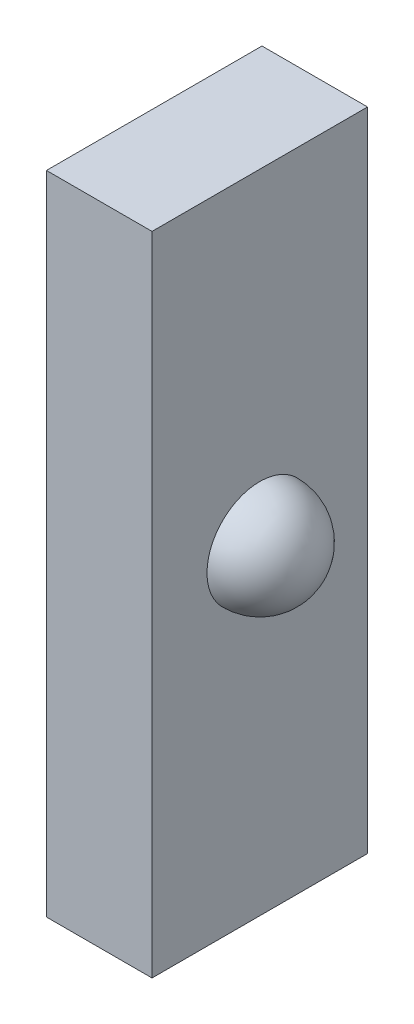
from build123d import *

# Parameters (mm, degrees)
REVOLVE_1_ANGLE            = 180
EXTRUDE_1_DEPTH            = 10
EXTRUDE_1_DEPTH_BACK       = 10
SKETCH_5_W                 = 9.796885282
SKETCH_5_H                 = 60
PATTERN_LINEAR_1_COUNT     = 2
PATTERN_LINEAR_1_PITCH     = 18.4
PATTERN_LINEAR_1_COL_COUNT = 2
PATTERN_LINEAR_1_COL_PITCH = 18.4


with BuildPart() as part:
    # 草图1 → 旋转1 (revolve)
    with BuildSketch(Plane(origin=(0, 0, 0), x_dir=(0, 0, -1), z_dir=(1, 0, 0))):
        with BuildLine():
            Line((0, 4.9), (0, -4.9))
            ThreePointArc((0, -4.9), (4.9, 0), (0, 4.9))
        make_face()
    revolve(axis=Axis((0, 4.9, 0), (0, -1, 0)), revolution_arc=REVOLVE_1_ANGLE)

    # 草图5 → 凸台-拉伸1 (add, two sides: drawn at the far end of the back side and taken through both)
    with BuildSketch(Plane.XY.offset(-EXTRUDE_1_DEPTH_BACK)):
        with Locations((-4.898442641, 0)):
            Rectangle(SKETCH_5_W, SKETCH_5_H)
    extrude(amount=EXTRUDE_1_DEPTH + EXTRUDE_1_DEPTH_BACK)

    # 草图7 → 切除-旋转1 (revolve, cut)
    with BuildSketch(Plane.XY):
        with BuildLine():
            Line((-9.796885282, 9.2), (-9.796885282, -9.2))
            ThreePointArc((-9.796885282, -9.2), (-18.996885282, 0), (-9.796885282, 9.2))
        make_face()
    cut_revolve_1 = revolve(axis=Axis((-9.796885282, 9.2, 0), (0, -1, 0)), mode=Mode.SUBTRACT)

    # 阵列(线性)1: 切除-旋转1 ×2
    with Locations(*[(0, i * PATTERN_LINEAR_1_PITCH, 0) for i in range(1, PATTERN_LINEAR_1_COUNT)]):
        add(cut_revolve_1, mode=Mode.SUBTRACT)

    # 阵列(线性)1 col: 切除-旋转1 ×2
    with Locations(*[(0, -i * PATTERN_LINEAR_1_COL_PITCH, 0) for i in range(1, PATTERN_LINEAR_1_COL_COUNT)]):
        add(cut_revolve_1, mode=Mode.SUBTRACT)


solid = part.part
